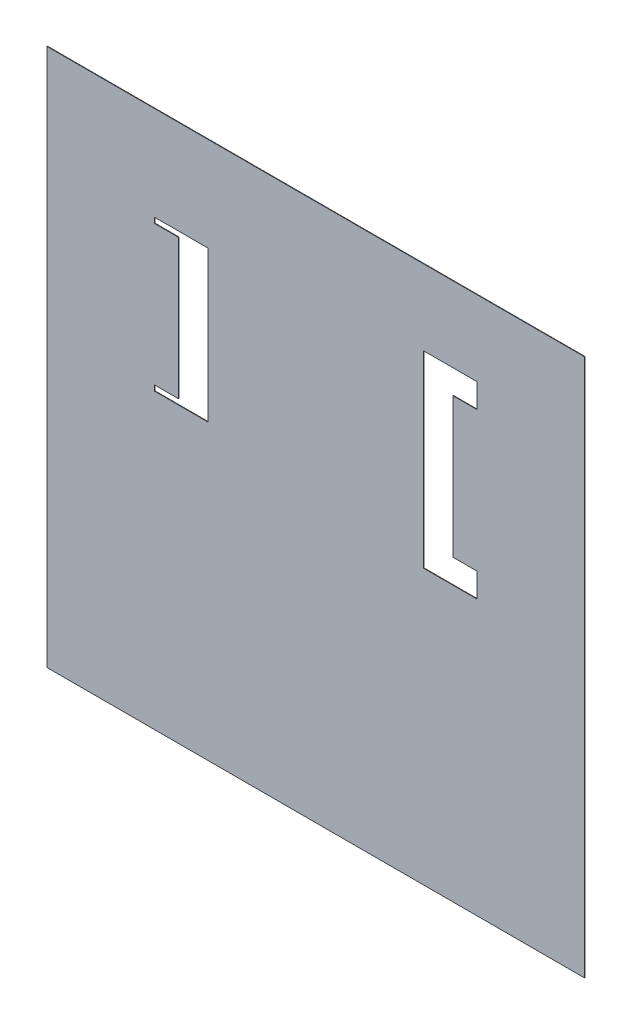
from build123d import *

# Parameters (mm, degrees)
SKETCH1_W           = 25.4
SKETCH1_H           = 25.4
BOSS_EXTRUDE1_DEPTH = 0.0254
CUT_EXTRUDE1_DEPTH  = 36.921033465


with BuildPart() as part:
    # Sketch1 → Boss-Extrude1 (new body)
    with BuildSketch(Plane.XY):
        with Locations((12.7, 12.7)):
            Rectangle(SKETCH1_W, SKETCH1_H)
    extrude(amount=BOSS_EXTRUDE1_DEPTH)

    # Sketch4 → Cut-Extrude1 (cut, through all)
    with BuildSketch(Plane.XY.offset(0.0254)):
        Polygon((5.08, 20.955), (7.62, 20.955), (7.62, 13.843), (5.08, 13.843), (5.08, 14.097), (6.223, 14.097), (6.223, 20.701), (5.08, 20.701), align=None)
        Polygon((17.78, 21.844), (20.32, 21.844), (20.32, 20.701), (19.177, 20.701), (19.177, 14.097), (20.32, 14.097), (20.32, 12.954), (17.78, 12.954), align=None)
    extrude(amount=-CUT_EXTRUDE1_DEPTH, mode=Mode.SUBTRACT)


solid = part.part
